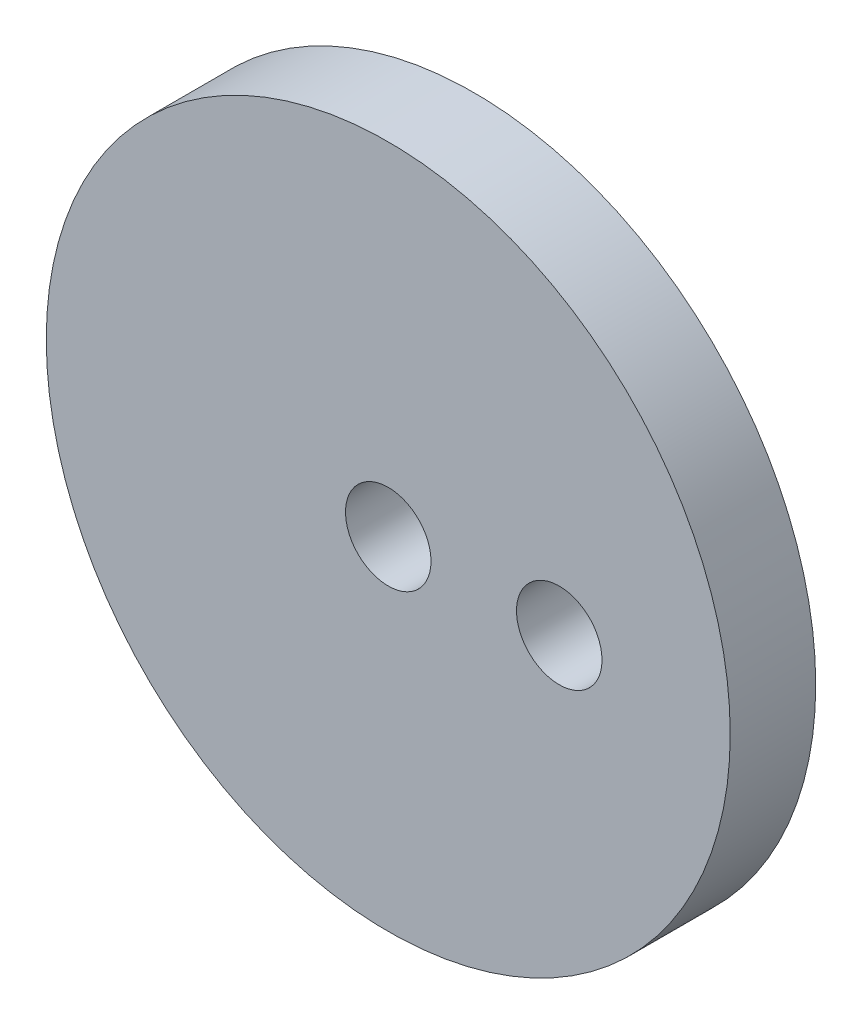
from build123d import *

# Parameters (mm, degrees)
SKETCH1_R           = 25.4
BOSS_EXTRUDE1_DEPTH = 6.35
SKETCH2_R           = 3.175
CUT_EXTRUDE1_DEPTH  = 37.477972806


with BuildPart() as part:
    # Sketch1 → Boss-Extrude1 (new body)
    with BuildSketch(Plane.XY):
        Circle(SKETCH1_R)
    extrude(amount=BOSS_EXTRUDE1_DEPTH)

    # Sketch2 → Cut-Extrude1 (cut, through all)
    with BuildSketch(Plane.XY.offset(6.35)):
        with Locations((12.7, 0)):
            Circle(SKETCH2_R)
        Circle(SKETCH2_R)
    extrude(amount=-CUT_EXTRUDE1_DEPTH, mode=Mode.SUBTRACT)


solid = part.part
